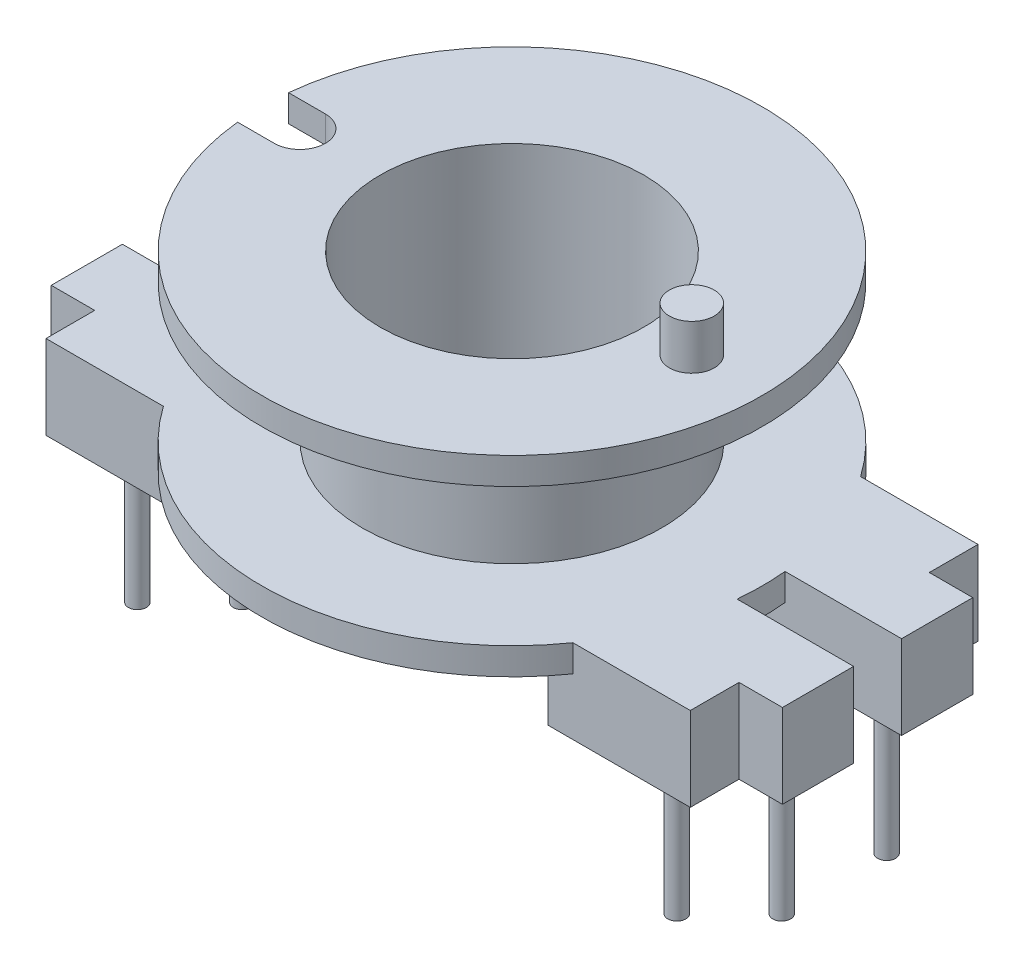
from build123d import *

# Parameters (mm, degrees)
SKETCH_2_R          = 0.75
EXTRUDE_1_DEPTH     = 1.5
CUT_EXTRUDE_1_DEPTH = 1.5
EXTRUDE_2_DEPTH     = 2.8
SKETCH_5_R          = 0.3
EXTRUDE_3_DEPTH     = 4.6


with BuildPart() as part:
    # 草图1 → 旋转1 (revolve)
    with BuildSketch(Plane.XY, mode=Mode.PRIVATE) as revolve_1_sk:
        Polygon((8.35, -5.5), (8.35, -6.4), (4.4, -6.4), (4.4, 0), (8.35, 0), (8.35, -0.9), (5, -0.9), (5, -5.5), align=None)
    revolve(revolve_1_sk.sketch.rotate(Axis((0, -3.284222298, 0), (0, 1, 0)), 90), axis=Axis((0, -3.284222298, 0), (0, 1, 0)))

    # 草图2 → 凸台-拉伸1 (add)
    with BuildSketch(Plane(origin=(0, 0, 0), x_dir=(1, 0, 0), z_dir=(0, 1, 0))):
        with Locations(Location((6, 0, 0), (0, 0, 270))):
            Circle(SKETCH_2_R)
    extrude(amount=EXTRUDE_1_DEPTH)

    # 草图3 → 切除-拉伸1 (cut)
    with BuildSketch(Plane(origin=(0, 0, 0), x_dir=(1, 0, 0), z_dir=(0, 1, 0))):
        with BuildLine():
            Line((-7.078375357, -0.851310072), (-10.983685898, -0.851310072))
            ThreePointArc((-10.983685898, -0.851310072), (-11.834995971, 0), (-10.983685898, 0.851310072))
            Line((-10.983685898, 0.851310072), (-7.078375357, 0.851310072))
            ThreePointArc((-7.078375357, 0.851310072), (-6.227065284, 0), (-7.078375357, -0.851310072))
        make_face()
    extrude(amount=-CUT_EXTRUDE_1_DEPTH, mode=Mode.SUBTRACT)

    # 草图4 → 凸台-拉伸2 (add)
    with BuildSketch(Plane(origin=(0, -5.5, 0), x_dir=(1, 0, 0), z_dir=(0, 1, 0))):
        with BuildLine():
            Line((-10.75, 4.8), (-6, 4.8))
            Line((-6, 4.8), (-6, -4.8))
            Line((-6, -4.8), (-10.75, -4.8))
            Line((-10.75, -4.8), (-10.75, -3.175))
            Line((-10.75, -3.175), (-12.2, -3.175))
            Line((-12.2, -3.175), (-12.2, -0.8))
            Line((-12.2, -0.8), (-7.078375357, -0.8))
            ThreePointArc((-7.078375357, -0.8), (-6.278375357, 0), (-7.078375357, 0.8))
            Line((-7.078375357, 0.8), (-12.2, 0.8))
            Line((-12.2, 0.8), (-12.2, 3.175))
            Line((-12.2, 3.175), (-10.75, 3.175))
            Line((-10.75, 3.175), (-10.75, 4.8))
        make_face()
        with BuildLine():
            Line((12.2, 3.175), (12.2, 0.8))
            Line((12.2, 0.8), (7.078375357, 0.8))
            ThreePointArc((7.078375357, 0.8), (6.278375357, 0), (7.078375357, -0.8))
            Line((7.078375357, -0.8), (12.2, -0.8))
            Line((12.2, -0.8), (12.2, -3.175))
            Line((12.2, -3.175), (10.75, -3.175))
            Line((10.75, -3.175), (10.75, -4.8))
            Line((10.75, -4.8), (6, -4.8))
            Line((6, -4.8), (6, 4.8))
            Line((6, 4.8), (10.75, 4.8))
            Line((10.75, 4.8), (10.75, 3.175))
            Line((10.75, 3.175), (12.2, 3.175))
        make_face()
    extrude(amount=-EXTRUDE_2_DEPTH)

    # 草图5 → 凸台-拉伸3 (add)
    with BuildSketch(Plane.XZ.offset(8.3)):
        with Locations(Location((-10.75, -1.75, 0), (0, 0, 90))):
            Circle(SKETCH_5_R)
        with Locations(Location((-7.25, -1.75, 0), (0, 0, 90))):
            Circle(SKETCH_5_R)
        with Locations(Location((-9, -3.5, 0), (0, 0, 90))):
            Circle(SKETCH_5_R)
        with Locations(Location((-9, 3.5, 0), (0, 0, 90))):
            Circle(SKETCH_5_R)
        with Locations(Location((-10.75, 1.75, 0), (0, 0, 90))):
            Circle(SKETCH_5_R)
        with Locations(Location((-7.25, 1.75, 0), (0, 0, 90))):
            Circle(SKETCH_5_R)
        with Locations(Location((7.25, 1.75, 0), (0, 0, 90))):
            Circle(SKETCH_5_R)
        with Locations(Location((10.75, 1.75, 0), (0, 0, 90))):
            Circle(SKETCH_5_R)
        with Locations(Location((10.75, -1.75, 0), (0, 0, 90))):
            Circle(SKETCH_5_R)
        with Locations(Location((7.25, -1.75, 0), (0, 0, 90))):
            Circle(SKETCH_5_R)
        with Locations(Location((9, -3.5, 0), (0, 0, 90))):
            Circle(SKETCH_5_R)
        with Locations(Location((9, 3.5, 0), (0, 0, 90))):
            Circle(SKETCH_5_R)
    extrude(amount=EXTRUDE_3_DEPTH)


solid = part.part
